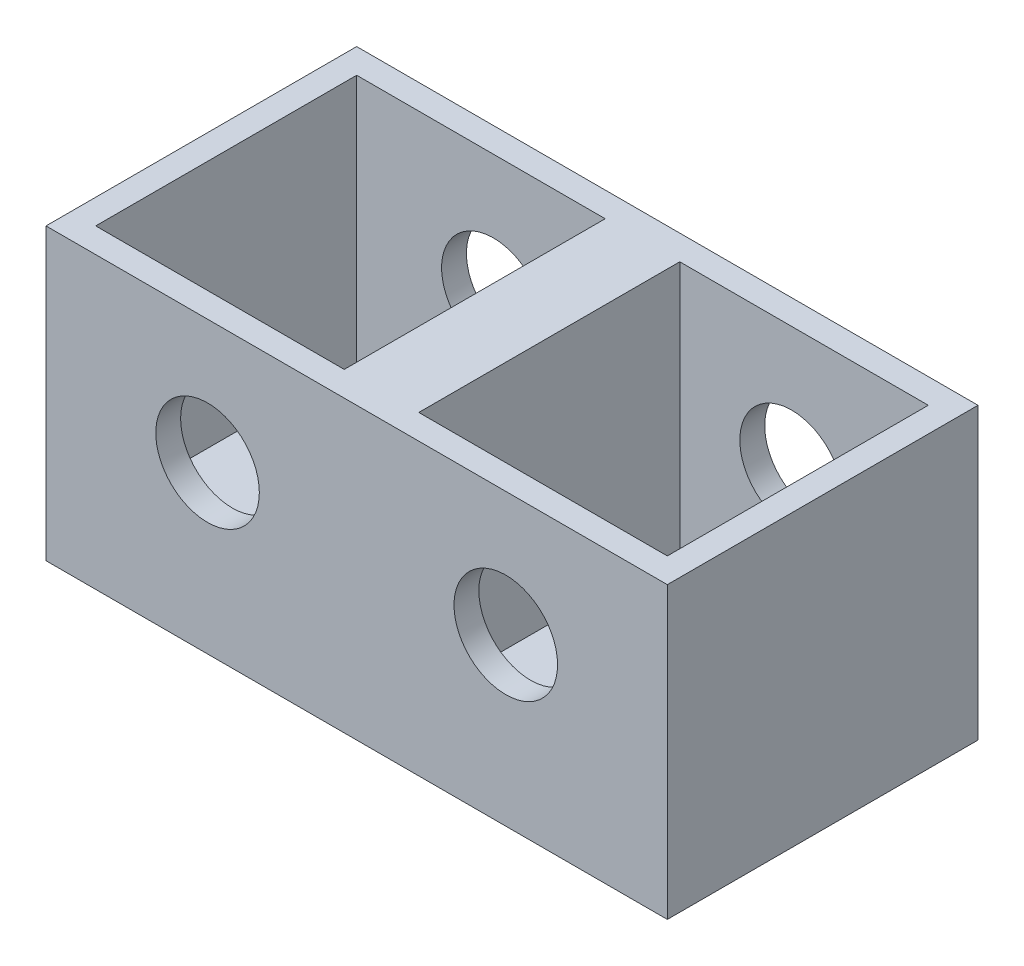
from build123d import *

# Parameters (mm, degrees)
SKETCH1_W           = 30
SKETCH1_H           = 15
BOSS_EXTRUDE1_DEPTH = 2
SKETCH2_W           = 1.2
SKETCH2_H           = 15
BOSS_EXTRUDE2_DEPTH = 12
SKETCH3_W           = 14.4
SKETCH3_H           = 15
SKETCH3_W_2         = 12
SKETCH3_H_2         = 12.6
BOSS_EXTRUDE3_DEPTH = 12
SKETCH4_R           = 2.5
CUT_EXTRUDE1_DEPTH  = 16
SKETCH5_W           = 14.4
SKETCH5_H           = 15
SKETCH5_W_2         = 12
SKETCH5_H_2         = 12.6
BOSS_EXTRUDE4_DEPTH = 12
SKETCH6_R           = 2.5
CUT_EXTRUDE2_DEPTH  = 16


with BuildPart() as part:
    # Sketch1 → Boss-Extrude1 (new body)
    with BuildSketch(Plane(origin=(0, 0, 0), x_dir=(1, 0, 0), z_dir=(0, 1, 0))):
        Rectangle(SKETCH1_W, SKETCH1_H)
    extrude(amount=BOSS_EXTRUDE1_DEPTH)

    # Sketch2 → Boss-Extrude2 (add)
    with BuildSketch(Plane(origin=(0, 2, 0), x_dir=(1, 0, 0), z_dir=(0, 1, 0))):
        Rectangle(SKETCH2_W, SKETCH2_H)
    extrude(amount=BOSS_EXTRUDE2_DEPTH)

    # Sketch3 → Boss-Extrude3 (add)
    with BuildSketch(Plane(origin=(0, 2, 0), x_dir=(1, 0, 0), z_dir=(0, 1, 0))):
        with Locations((7.8, 0)):
            Rectangle(SKETCH3_W, SKETCH3_H)
        with Locations((7.8, 0)):
            Rectangle(SKETCH3_W_2, SKETCH3_H_2, mode=Mode.SUBTRACT)
    extrude(amount=BOSS_EXTRUDE3_DEPTH)

    # Sketch4 → Cut-Extrude1 (cut)
    with BuildSketch(Plane.XY.offset(7.5)):
        with Locations((7.2, 8)):
            Circle(SKETCH4_R)
    extrude(amount=-CUT_EXTRUDE1_DEPTH, mode=Mode.SUBTRACT)

    # Sketch5 → Boss-Extrude4 (add)
    with BuildSketch(Plane(origin=(0, 2, 0), x_dir=(1, 0, 0), z_dir=(0, 1, 0))):
        with Locations((-7.8, 0)):
            Rectangle(SKETCH5_W, SKETCH5_H)
        with Locations((-7.8, 0)):
            Rectangle(SKETCH5_W_2, SKETCH5_H_2, mode=Mode.SUBTRACT)
    extrude(amount=BOSS_EXTRUDE4_DEPTH)

    # Sketch6 → Cut-Extrude2 (cut)
    with BuildSketch(Plane.XY.offset(7.5)):
        with Locations((-7.2, 8)):
            Circle(SKETCH6_R)
    extrude(amount=-CUT_EXTRUDE2_DEPTH, mode=Mode.SUBTRACT)


solid = part.part
